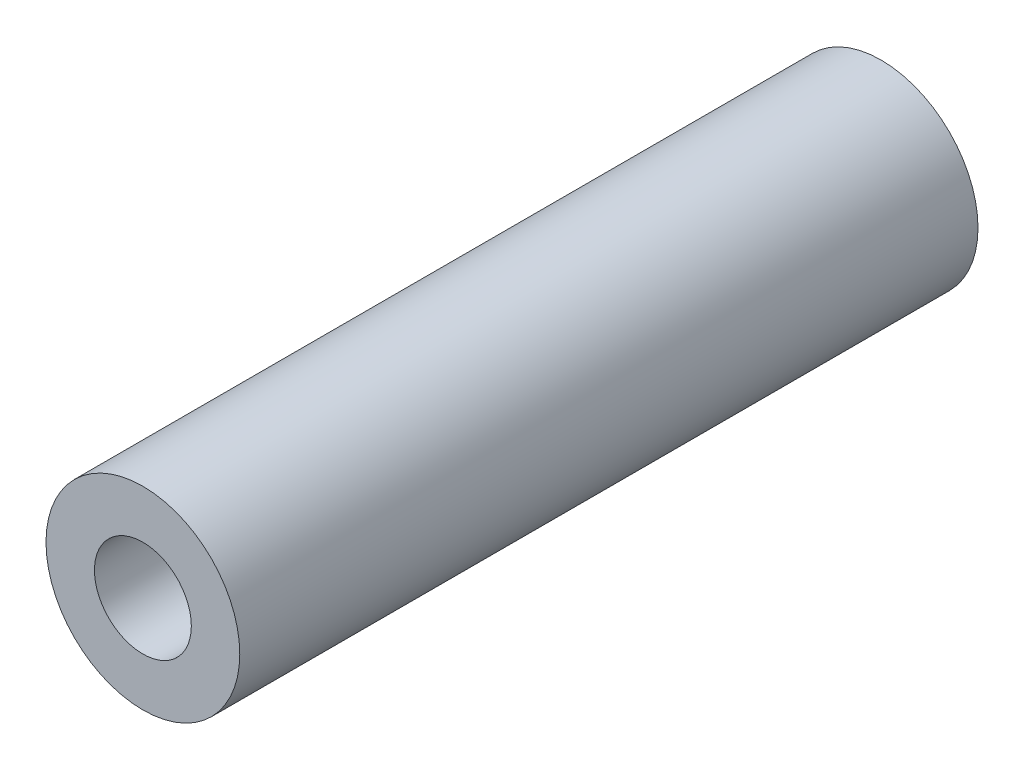
from build123d import *

# Parameters (mm, degrees)
SKETCH2_R           = 5
BOSS_EXTRUDE1_DEPTH = 10
SKETCH3_R           = 10
SKETCH3_R_2         = 5
BOSS_EXTRUDE2_DEPTH = 76.2
BOSS_EXTRUDE3_START = 86.2
SKETCH2_2_R         = 5
BOSS_EXTRUDE3_DEPTH = 22
SKETCH5_R           = 65
BOSS_EXTRUDE4_DEPTH = 22
SKETCH6_R           = 55
CUT_EXTRUDE1_DEPTH  = 22
SKETCH7_R           = 80
CUT_EXTRUDE2_DEPTH  = 22
SKETCH8_R           = 80
CUT_EXTRUDE3_DEPTH  = 10


with BuildPart() as part:
    # Sketch2 → Boss-Extrude1 (new body)
    with BuildSketch(Plane.XY):
        with BuildLine():
            Line((-19.794866372, 2.857142857), (-9.897433186, 71.428571429))
            ThreePointArc((-9.897433186, 71.428571429), (0, 80), (9.897433186, 71.428571429))
            Line((9.897433186, 71.428571429), (19.794866372, 2.857142857))
            ThreePointArc((19.794866372, 2.857142857), (0, -20), (-19.794866372, 2.857142857))
        make_face()
        with Locations((0, 70)):
            Circle(SKETCH2_R, mode=Mode.SUBTRACT)
        with BuildLine():
            Line((-2.5, 9.682458366), (-2.5, 12))
            Line((-2.5, 12), (2.5, 12))
            Line((2.5, 12), (2.5, 9.682458366))
            ThreePointArc((2.5, 9.682458366), (0, -10), (-2.5, 9.682458366))
        make_face(mode=Mode.SUBTRACT)
    extrude(amount=BOSS_EXTRUDE1_DEPTH)

    # Sketch3 → Boss-Extrude2 (add)
    with BuildSketch(Plane.XY.offset(10)):
        with Locations(Location((0, 70, 0), (0, 0, 171.786789298))):
            Circle(SKETCH3_R)
        with Locations((0, 70)):
            Circle(SKETCH3_R_2, mode=Mode.SUBTRACT)
    extrude(amount=BOSS_EXTRUDE2_DEPTH)

    # Sketch2<2> → Boss-Extrude3 (add)
    with BuildSketch(Plane.XY.offset(BOSS_EXTRUDE3_START)):
        with BuildLine():
            Line((-19.794866372, 2.857142857), (-9.897433186, 71.428571429))
            ThreePointArc((-9.897433186, 71.428571429), (0, 80), (9.897433186, 71.428571429))
            Line((9.897433186, 71.428571429), (19.794866372, 2.857142857))
            ThreePointArc((19.794866372, 2.857142857), (0, -20), (-19.794866372, 2.857142857))
        make_face()
        with Locations((0, 70)):
            Circle(SKETCH2_2_R, mode=Mode.SUBTRACT)
        with BuildLine():
            Line((-2.5, 9.682458366), (-2.5, 12))
            Line((-2.5, 12), (2.5, 12))
            Line((2.5, 12), (2.5, 9.682458366))
            ThreePointArc((2.5, 9.682458366), (0, -10), (-2.5, 9.682458366))
        make_face(mode=Mode.SUBTRACT)
    extrude(amount=BOSS_EXTRUDE3_DEPTH)

    # Sketch5 → Boss-Extrude4 (add)
    with BuildSketch(Plane.XY.offset(108.2)):
        Circle(SKETCH5_R)
    extrude(amount=-BOSS_EXTRUDE4_DEPTH)

    # Sketch6 → Cut-Extrude1 (cut)
    with BuildSketch(Plane.XY.offset(108.2)):
        Circle(SKETCH6_R)
    extrude(amount=-CUT_EXTRUDE1_DEPTH, mode=Mode.SUBTRACT)

    # Sketch7 → Cut-Extrude2 (cut)
    with BuildSketch(Plane.XY.offset(108.2)):
        Circle(SKETCH7_R)
    extrude(amount=-CUT_EXTRUDE2_DEPTH, mode=Mode.SUBTRACT)

    # Sketch8 → Cut-Extrude3 (cut)
    with BuildSketch(Plane(origin=(0, 0, 0), x_dir=(-1, 0, 0), z_dir=(0, 0, -1))):
        Circle(SKETCH8_R)
    extrude(amount=-CUT_EXTRUDE3_DEPTH, mode=Mode.SUBTRACT)


solid = part.part
